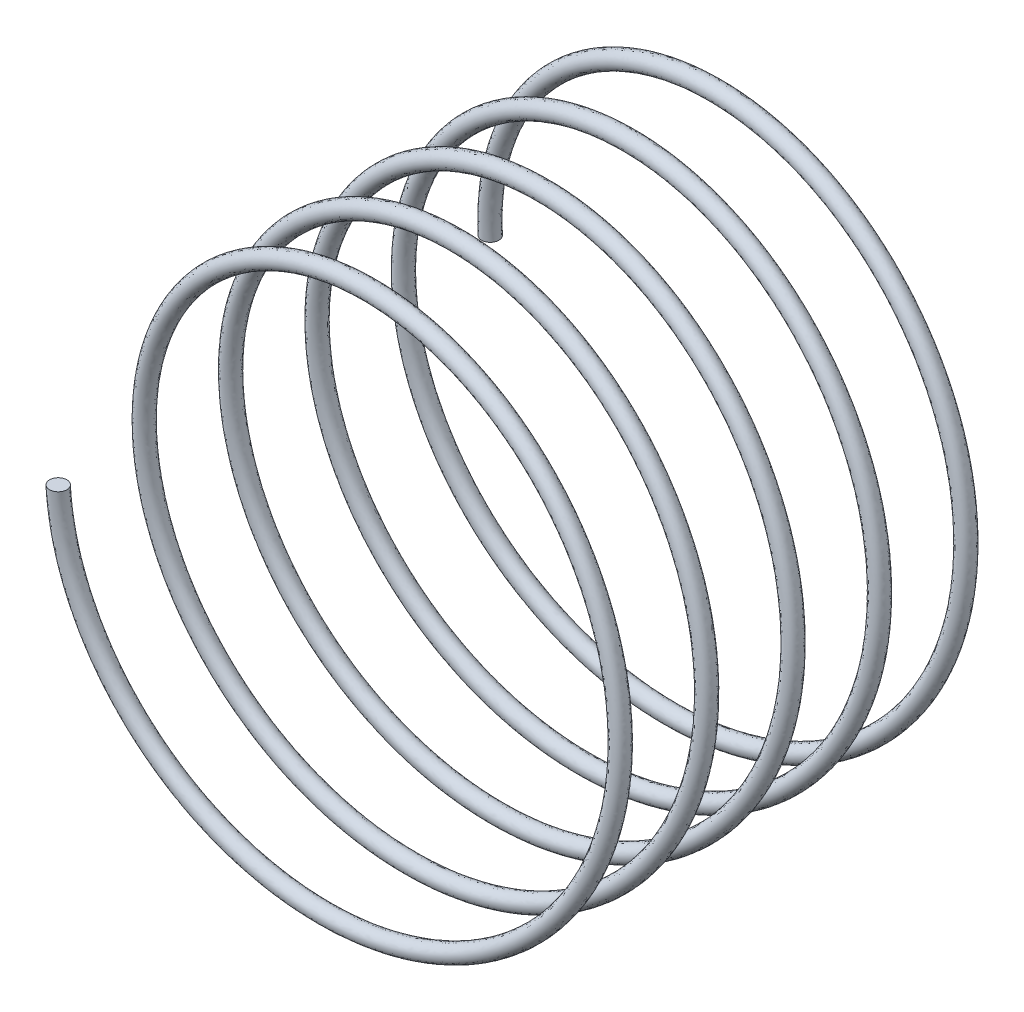
from build123d import *

# Parameters (mm, degrees)
VARREDURA1_PITCH       = 10
VARREDURA1_HEIGHT      = 50
VARREDURA1_RADIUS      = 30
VARREDURA1_START_ANGLE = -180
ESBO_O3_R              = 1


with BuildPart() as part:
    # Varredura1: sweep along a helix
    with BuildLine() as varredura1_path:
        add(Helix(VARREDURA1_PITCH, VARREDURA1_HEIGHT, VARREDURA1_RADIUS, center=(0, 0, 0), direction=(0, 0, 1), lefthand=True, mode=Mode.PRIVATE).rotate(Axis((0, 0, 0), (0, 0, 1)), VARREDURA1_START_ANGLE))
    # Esboço3 → Varredura1 (sweep)
    with BuildSketch(Plane(origin=(0, 0, 0), x_dir=(1, 0, 0), z_dir=(0, 1, 0))):
        with Locations((-29.99985619, -49.995098985)):
            Circle(ESBO_O3_R)
    sweep(path=varredura1_path.line, is_frenet=True)


solid = part.part
